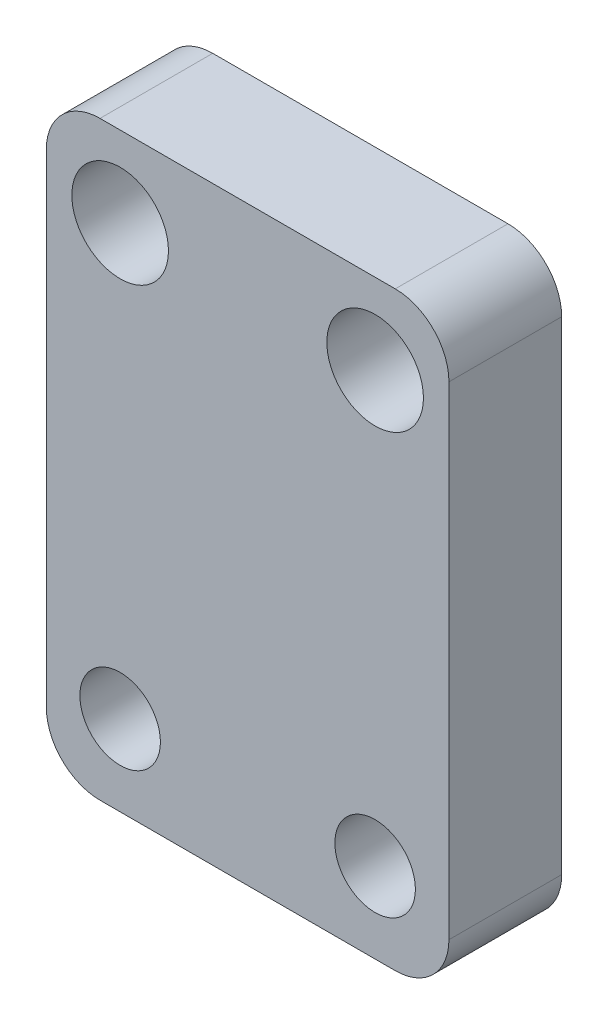
from build123d import *

# Parameters (mm, degrees)
SKETCH1_W           = 15
SKETCH1_H           = 22
SKETCH1_R           = 1.8
SKETCH1_R_2         = 1.5
BOSS_EXTRUDE1_DEPTH = 4.2
FILLET1_R           = 2


with BuildPart() as part:
    # Sketch1 → Boss-Extrude1 (new body)
    with BuildSketch(Plane.XY):
        Rectangle(SKETCH1_W, SKETCH1_H)
        with Locations((-4.75, 8)):
            Circle(SKETCH1_R, mode=Mode.SUBTRACT)
        with Locations((4.75, 8)):
            Circle(SKETCH1_R, mode=Mode.SUBTRACT)
        with Locations((-4.75, -8)):
            Circle(SKETCH1_R_2, mode=Mode.SUBTRACT)
        with Locations((4.75, -8)):
            Circle(SKETCH1_R_2, mode=Mode.SUBTRACT)
    extrude(amount=BOSS_EXTRUDE1_DEPTH)

    # Fillet1
    fillet1_edges = [part.edges().sort_by_distance(p)[0] for p in [
        (7.5, -11, 2.1),
        (-7.5, -11, 2.1),
        (-7.5, 11, 2.1),
        (7.5, 11, 2.1),
    ]]
    fillet(fillet1_edges, radius=FILLET1_R)


solid = part.part
